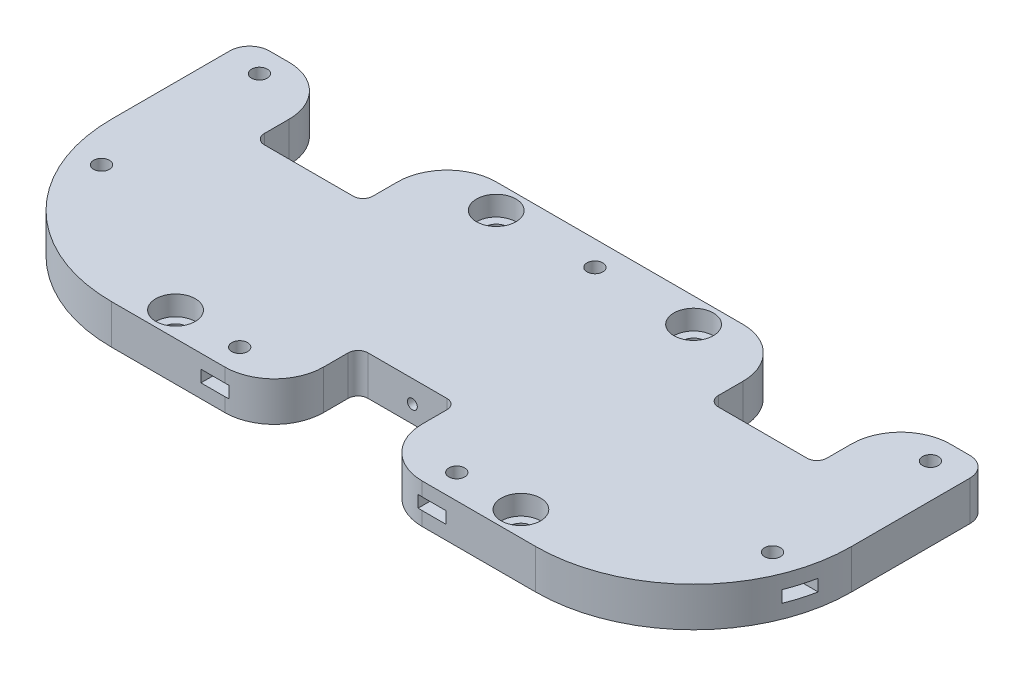
from build123d import *

# Parameters (mm, degrees)
SKETCH1_W                      = 150
SKETCH1_H                      = 26
BOSS_EXTRUDE1_DEPTH            = 8
SKETCH2_R                      = 1
CUT_EXTRUDE1_DEPTH             = 10
SKETCH3_R                      = 1
CUT_EXTRUDE2_DEPTH             = 10
SKETCH4_W                      = 65
SKETCH4_H                      = 30
BOSS_EXTRUDE2_DEPTH            = 8
FILLET1_R                      = 32
SKETCH5_W                      = 70
SKETCH5_H                      = 30
BOSS_EXTRUDE3_DEPTH            = 8
CBORE_FOR_M4_SHCS1_D           = 4.5
CBORE_FOR_M4_SHCS1_CBORE_D     = 8
CBORE_FOR_M4_SHCS1_CBORE_DEPTH = 4
SKETCH10_W                     = 18
SKETCH10_H                     = 17
BOSS_EXTRUDE4_DEPTH            = 8
FILLET2_R                      = 10
FILLET3_R                      = 2
FILLET4_R                      = 4
SKETCH11_R                     = 1.6
CUT_EXTRUDE3_DEPTH             = 82.172655494
CUT_EXTRUDE5_START             = -5.2
CUT_EXTRUDE5_DEPTH             = 2.4


with BuildPart() as part:
    # Sketch1 → Boss-Extrude1 (new body)
    with BuildSketch(Plane(origin=(0, 0, 0), x_dir=(1, 0, 0), z_dir=(0, 1, 0))):
        Rectangle(SKETCH1_W, SKETCH1_H)
    extrude(amount=BOSS_EXTRUDE1_DEPTH)

    # Sketch2 → Cut-Extrude1 (cut)
    with BuildSketch(Plane(origin=(0, 0, -13), x_dir=(-1, 0, 0), z_dir=(0, 0, -1))):
        with Locations((47.4, 3.5)):
            Circle(SKETCH2_R)
        with Locations((-49.4, 3.5)):
            Circle(SKETCH2_R)
    extrude(amount=-CUT_EXTRUDE1_DEPTH, mode=Mode.SUBTRACT)

    # Sketch3 → Cut-Extrude2 (cut)
    with BuildSketch(Plane.XY.offset(13)):
        with Locations((1, 3.5)):
            Circle(SKETCH3_R)
    extrude(amount=-CUT_EXTRUDE2_DEPTH, mode=Mode.SUBTRACT)

    # Sketch4 → Boss-Extrude2 (add)
    with BuildSketch(Plane(origin=(0, 0, 0), x_dir=(1, 0, 0), z_dir=(0, 1, 0))):
        with Locations((-42.5, -15)):
            Rectangle(SKETCH4_W, SKETCH4_H)
        with Locations((42.5, -15)):
            Rectangle(SKETCH4_W, SKETCH4_H)
    extrude(amount=BOSS_EXTRUDE2_DEPTH)

    # Fillet1
    fillet1_edges = [part.edges().sort_by_distance(p)[0] for p in [
        (-75, 4, 30),
        (75, 4, 30),
    ]]
    fillet(fillet1_edges, radius=FILLET1_R)

    # Sketch5 → Boss-Extrude3 (add)
    with BuildSketch(Plane(origin=(0, 0, 0), x_dir=(1, 0, 0), z_dir=(0, 1, 0))):
        with Locations((0, 15)):
            Rectangle(SKETCH5_W, SKETCH5_H)
    extrude(amount=BOSS_EXTRUDE3_DEPTH)

    # CBORE for M4 SHCS1 (through all)
    with Locations(Plane(origin=(0, 8, 0), x_dir=(1, 0, 0), z_dir=(0, 1, 0))):
        with Locations((-20, 25), (20, 25), (35, -25), (-35, -25)):
            CounterBoreHole(CBORE_FOR_M4_SHCS1_D / 2, CBORE_FOR_M4_SHCS1_CBORE_D / 2, CBORE_FOR_M4_SHCS1_CBORE_DEPTH)

    # Sketch10 → Boss-Extrude4 (add)
    with BuildSketch(Plane(origin=(0, 8, 0), x_dir=(1, 0, 0), z_dir=(0, 1, 0))):
        with Locations((-66, 21.5)):
            Rectangle(SKETCH10_W, SKETCH10_H)
        with Locations((66, 21.5)):
            Rectangle(SKETCH10_W, SKETCH10_H)
    extrude(amount=-BOSS_EXTRUDE4_DEPTH)

    # Fillet2
    fillet2_edges = [part.edges().sort_by_distance(p)[0] for p in [
        (-57, 4, -30),
        (57, 4, -30),
        (-10, 4, 30),
        (10, 4, 30),
        (-35, 4, -30),
        (35, 4, -30),
    ]]
    fillet(fillet2_edges, radius=FILLET2_R)

    # Fillet3
    fillet3_edges = [part.edges().sort_by_distance(p)[0] for p in [
        (-57, 4, -13),
        (57, 4, -13),
        (-10, 4, 13),
        (10, 4, 13),
        (-35, 4, -13),
        (35, 4, -13),
    ]]
    fillet(fillet3_edges, radius=FILLET3_R)

    # Fillet4
    fillet4_edges = [part.edges().sort_by_distance(p)[0] for p in [
        (-75, 4, -30),
        (75, 4, -30),
    ]]
    fillet(fillet4_edges, radius=FILLET4_R)

    # Sketch11 → Cut-Extrude3 (cut, through all)
    with BuildSketch(Plane(origin=(0, 8, 0), x_dir=(1, 0, 0), z_dir=(0, 1, 0))):
        with Locations(Location((-68, 25, 0), (0, 0, 270))):
            Circle(SKETCH11_R)
        with Locations(Location((-68, -7, 0), (0, 0, 270))):
            Circle(SKETCH11_R)
        with Locations(Location((0, 25, 0), (0, 0, 270))):
            Circle(SKETCH11_R)
        with Locations(Location((-22, -25, 0), (0, 0, 270))):
            Circle(SKETCH11_R)
        with Locations(Location((22, -25, 0), (0, 0, 270))):
            Circle(SKETCH11_R)
        with Locations(Location((68, -7, 0), (0, 0, 270))):
            Circle(SKETCH11_R)
        with Locations(Location((68, 25, 0), (0, 0, 270))):
            Circle(SKETCH11_R)
    extrude(amount=-CUT_EXTRUDE3_DEPTH, mode=Mode.SUBTRACT)

    # Sketch14 → Cut-Extrude5 (cut)
    with BuildSketch(Plane(origin=(0, 8, 0), x_dir=(1, 0, 0), z_dir=(0, 1, 0)).offset(CUT_EXTRUDE5_START)):
        Polygon((19.15, -26.645448267), (19.15, -29.963809512), (19.15, -31.088367393), (24.85, -31.088367393), (24.85, -30), (24.85, -26.645448267), (24.85, -23.354551733), (22, -21.709103466), (19.15, -23.354551733), align=None)
        Polygon((-70.85, 26.645448267), (-70.85, 23.354551733), (-68, 21.709103466), (-65.15, 23.354551733), (-65.15, 26.645448267), (-65.15, 32.162081996), (-70.85, 32.162081996), align=None)
        Polygon((-66.354551733, -9.85), (-64.709103466, -7), (-66.354551733, -4.15), (-69.645448267, -4.15), (-77.063489816, -4.15), (-77.063489816, -9.85), (-69.645448267, -9.85), align=None)
        Polygon((69.645448267, -4.15), (74.85540498, -4.15), (74.85540498, -9.85), (69.645448267, -9.85), (66.354551733, -9.85), (64.709103466, -7), (66.354551733, -4.15), align=None)
        Polygon((-19.15, -26.645448267), (-19.15, -23.354551733), (-22, -21.709103466), (-24.85, -23.354551733), (-24.85, -26.645448267), (-24.85, -31.723869118), (-19.15, -31.723869118), align=None)
        Polygon((65.15, 26.645448267), (65.15, 32.162081996), (70.85, 32.162081996), (70.85, 26.645448267), (70.85, 23.354551733), (68, 21.709103466), (65.15, 23.354551733), align=None)
        Polygon((-2.85, 26.645448267), (-2.85, 23.354551733), (0, 21.709103466), (2.85, 23.354551733), (2.85, 26.645448267), (2.85, 32.162081996), (-2.85, 32.162081996), align=None)
    extrude(amount=CUT_EXTRUDE5_DEPTH, mode=Mode.SUBTRACT)


solid = part.part
